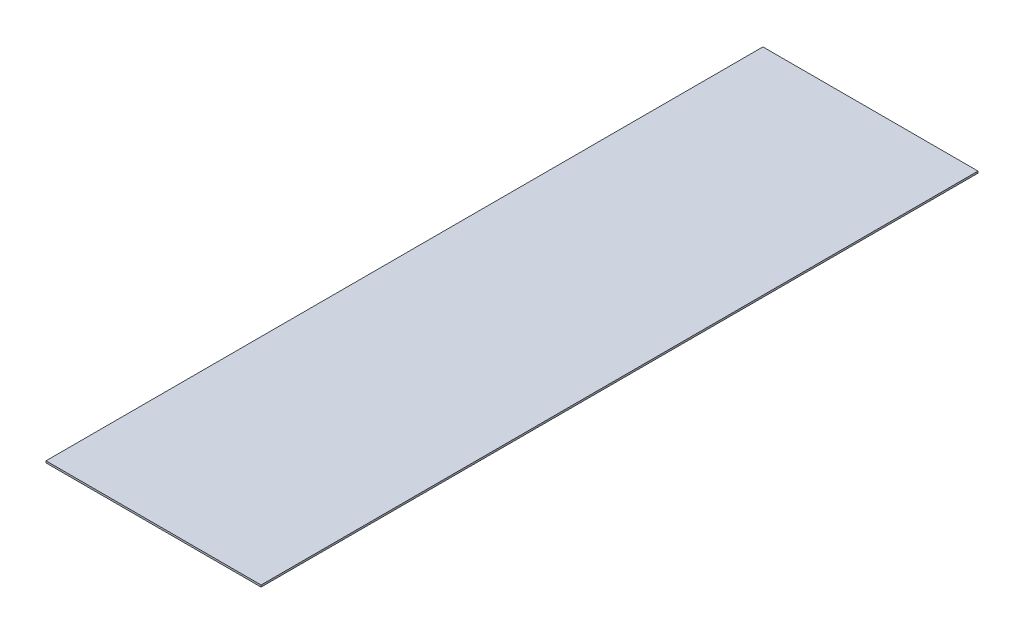
from build123d import *

# Parameters (mm, degrees)
CROQUIS1_W              = 914.4
CROQUIS1_H              = 3048
SALIENTE_EXTRUIR1_DEPTH = 7.9


with BuildPart() as part:
    # Croquis1 → Saliente-Extruir1 (new body)
    with BuildSketch(Plane(origin=(0, 0, 0), x_dir=(1, 0, 0), z_dir=(0, 1, 0))):
        Rectangle(CROQUIS1_W, CROQUIS1_H)
    extrude(amount=SALIENTE_EXTRUIR1_DEPTH)


solid = part.part
